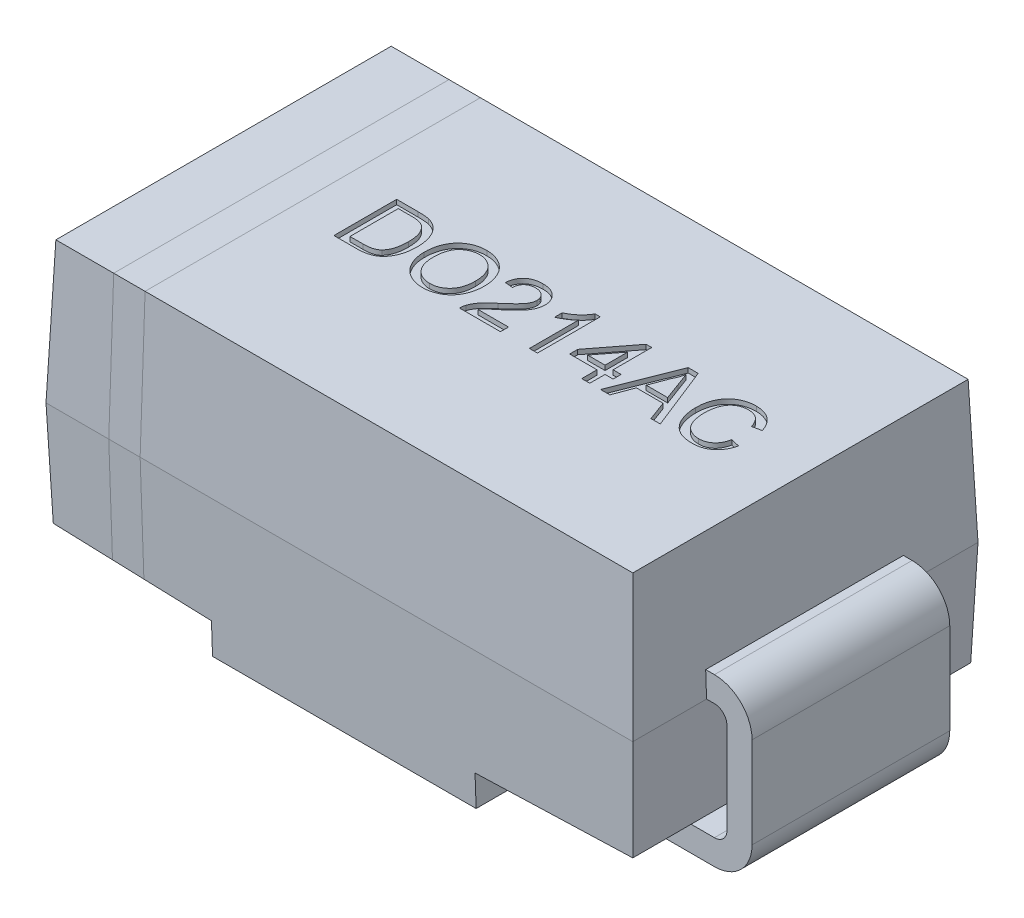
from build123d import *

# Parameters (mm, degrees)
SKETCH1_W                      = 4.7498
SKETCH1_H                      = 2.794
EXTRUDE1_DEPTH                 = 1.143
EXTRUDE1_TAPER                 = 2
EXTRUDE1_OTHER_WAY_DEPTH       = 1.143
EXTRUDE1_OTHER_WAY_TAPER       = 2
CUT_EXTRUDE1_REACH             = 4.983
CUT_EXTRUDE1_DIRECTION_2_REACH = 4.983
EXTRUDE2_DEPTH                 = 0.8001
CUT_EXTRUDE2_DEPTH             = 0.0381


with BuildPart() as part:
    # Sketch1 → Extrude1 (new body)
    with BuildSketch(Plane(origin=(0, 0, 0), x_dir=(1, 0, 0), z_dir=(0, 1, 0))):
        Rectangle(SKETCH1_W, SKETCH1_H)
    extrude(amount=EXTRUDE1_DEPTH, taper=EXTRUDE1_TAPER)

    # Sketch1 → Extrude1 other way (add)
    with BuildSketch(Plane(origin=(0, 0, 0), x_dir=(1, 0, 0), z_dir=(0, 1, 0))):
        Rectangle(SKETCH1_W, SKETCH1_H)
    extrude(amount=-EXTRUDE1_OTHER_WAY_DEPTH, taper=EXTRUDE1_OTHER_WAY_TAPER)

    # Cut-Extrude1: up to this plane
    cut_extrude1_end = Plane(origin=(-2.3749, 0, 1.397), z_dir=(0, -0.034899496702501046, 0.9993908270190958))
    # Sketch2 → Cut-Extrude1 (cut, up to the surface)
    with BuildSketch(Plane.XY, mode=Mode.PRIVATE) as cut_extrude1_sk1:
        Polygon((1.0668, -0.889), (1.0668, -1.143), (2.33498556, -1.143), (2.345414656, -0.844349792), align=None)
    cut_extrude1_tool1 = split(extrude(cut_extrude1_sk1.sketch, amount=CUT_EXTRUDE1_REACH, mode=Mode.PRIVATE), bisect_by=cut_extrude1_end, keep=Keep.BOTH, mode=Mode.PRIVATE)
    add(cut_extrude1_tool1.solids().sort_by_distance((1.720586, -1.004365, 0))[0], mode=Mode.SUBTRACT)
    # Sketch2 → Cut-Extrude1 (cut, up to the surface)
    with BuildSketch(Plane.XY, mode=Mode.PRIVATE) as cut_extrude1_sk2:
        Polygon((-1.0668, -0.889), (-1.0668, -1.143), (-2.33498556, -1.143), (-2.345414656, -0.844349792), align=None)
    cut_extrude1_tool2 = split(extrude(cut_extrude1_sk2.sketch, amount=CUT_EXTRUDE1_REACH, mode=Mode.PRIVATE), bisect_by=cut_extrude1_end, keep=Keep.BOTH, mode=Mode.PRIVATE)
    add(cut_extrude1_tool2.solids().sort_by_distance((-1.720586, -1.004365, 0))[0], mode=Mode.SUBTRACT)

    # Cut-Extrude1 direction 2: up to this plane
    cut_extrude1_direction_2_end = Plane(origin=(-2.3749, 0, -1.397), z_dir=(0, -0.034899496702501046, -0.9993908270190958))
    # Sketch2 → Cut-Extrude1 direction 2 (cut, up to the surface)
    with BuildSketch(Plane.XY, mode=Mode.PRIVATE) as cut_extrude1_direction_2_sk1:
        Polygon((1.0668, -0.889), (1.0668, -1.143), (2.33498556, -1.143), (2.345414656, -0.844349792), align=None)
    cut_extrude1_direction_2_tool1 = split(extrude(cut_extrude1_direction_2_sk1.sketch, amount=-CUT_EXTRUDE1_DIRECTION_2_REACH, mode=Mode.PRIVATE), bisect_by=cut_extrude1_direction_2_end, keep=Keep.BOTH, mode=Mode.PRIVATE)
    add(cut_extrude1_direction_2_tool1.solids().sort_by_distance((1.720586, -1.004365, 0))[0], mode=Mode.SUBTRACT)
    # Sketch2 → Cut-Extrude1 direction 2 (cut, up to the surface)
    with BuildSketch(Plane.XY, mode=Mode.PRIVATE) as cut_extrude1_direction_2_sk2:
        Polygon((-1.0668, -0.889), (-1.0668, -1.143), (-2.33498556, -1.143), (-2.345414656, -0.844349792), align=None)
    cut_extrude1_direction_2_tool2 = split(extrude(cut_extrude1_direction_2_sk2.sketch, amount=-CUT_EXTRUDE1_DIRECTION_2_REACH, mode=Mode.PRIVATE), bisect_by=cut_extrude1_direction_2_end, keep=Keep.BOTH, mode=Mode.PRIVATE)
    add(cut_extrude1_direction_2_tool2.solids().sort_by_distance((-1.720586, -1.004365, 0))[0], mode=Mode.SUBTRACT)

    # Sketch3 → Extrude2 (add, symmetric)
    with BuildSketch(Plane.XY):
        with BuildLine():
            Line((2.3678041, 0.2032), (2.4384, 0.2032))
            ThreePointArc((2.4384, 0.2032), (2.653926147, 0.113926147), (2.7432, -0.1016))
            Line((2.7432, -0.1016), (2.7432, -0.8382))
            ThreePointArc((2.7432, -0.8382), (2.653926147, -1.053726147), (2.4384, -1.143))
            Line((2.4384, -1.143), (1.5367, -1.143))
            Line((1.5367, -1.143), (1.5367, -0.9398))
            Line((1.5367, -0.9398), (2.4384, -0.9398))
            ThreePointArc((2.4384, -0.9398), (2.510242049, -0.910042049), (2.54, -0.8382))
            Line((2.54, -0.8382), (2.54, -0.1016))
            ThreePointArc((2.54, -0.1016), (2.510242049, -0.029757951), (2.4384, 0))
            Line((2.4384, 0), (2.3749, 0))
            Line((2.3749, 0), (2.3678041, 0.2032))
        make_face()
        with BuildLine():
            Line((-2.367463797, 0.212944979), (-2.3749, 0))
            Line((-2.3749, 0), (-2.4384, 0))
            ThreePointArc((-2.4384, 0), (-2.510242049, -0.029757951), (-2.54, -0.1016))
            Line((-2.54, -0.1016), (-2.54, -0.8382))
            ThreePointArc((-2.54, -0.8382), (-2.510242049, -0.910042049), (-2.4384, -0.9398))
            Line((-2.4384, -0.9398), (-1.5367, -0.9398))
            Line((-1.5367, -0.9398), (-1.5367, -1.143))
            Line((-1.5367, -1.143), (-2.4384, -1.143))
            ThreePointArc((-2.4384, -1.143), (-2.653926147, -1.053726147), (-2.7432, -0.8382))
            Line((-2.7432, -0.8382), (-2.7432, -0.1016))
            ThreePointArc((-2.7432, -0.1016), (-2.653926147, 0.113926147), (-2.4384, 0.2032))
            Line((-2.4384, 0.2032), (-2.367463797, 0.212944979))
        make_face()
    extrude(amount=EXTRUDE2_DEPTH, both=True)

    # Sketch5 → Cut-Extrude2 (cut)
    # profile 1 of 7: a face of its own
    with BuildSketch(Plane(origin=(0, 1.143, 0), x_dir=(1, 0, 0), z_dir=(0, 1, 0))):
        with BuildLine():
            Line((-1.239701999, -0.201883132), (-1.239701999, 0.306116868))
            Line((-1.239701999, 0.306116868), (-1.065992864, 0.306116868))
            add(Edge.make_bspline(
                [(-1.065992864, 0.306116868), (-1.061243888, 0.306095414), (-1.052016264, 0.306053727), (-1.038612202, 0.305788039), (-1.026061099, 0.305147202), (-1.014420787, 0.304366578), (-1.003632561, 0.303327244), (-0.993710201, 0.30216501), (-0.984645968, 0.300649027), (-0.978947184, 0.299388963), (-0.976238057, 0.298789945)],
                knots=[0, 0, 0, 0, 1.263127796, 2.454354013, 3.565393221, 4.605443485, 5.557051711, 6.447822442, 7.26211484, 8, 8, 8, 8], degree=3))
            add(Edge.make_bspline(
                [(-0.976238057, 0.298789945), (-0.969231785, 0.296951768), (-0.95546728, 0.293340489), (-0.936037234, 0.285217384), (-0.918199605, 0.275028432), (-0.907620769, 0.266635663), (-0.902358249, 0.262460618)],
                knots=[0, 0, 0, 0, 1.04477941, 2.052571232, 3.03123721, 4, 4, 4, 4], degree=3))
            add(Edge.make_bspline(
                [(-0.902358249, 0.262460618), (-0.89909078, 0.25959125), (-0.892541052, 0.253839526), (-0.88354504, 0.24436314), (-0.875199588, 0.234310235), (-0.86725543, 0.22385388), (-0.860220668, 0.212612863), (-0.853626566, 0.200910731), (-0.847874912, 0.188512489), (-0.842580601, 0.175620761), (-0.837863731, 0.162185298), (-0.833988043, 0.148214777), (-0.83042752, 0.133855083), (-0.827779317, 0.11894925), (-0.825467573, 0.103623709), (-0.824000015, 0.087790743), (-0.823047815, 0.071497617), (-0.822937469, 0.060462837), (-0.822881486, 0.054864464)],
                knots=[0, 0, 0, 0, 0.908997367, 1.822109427, 2.728529095, 3.640759027, 4.565643067, 5.499218265, 6.448003669, 7.421473682, 8.413047621, 9.423472075, 10.452328391, 11.505545429, 12.587978234, 13.692612971, 14.829372988, 16, 16, 16, 16], degree=3))
            add(Edge.make_bspline(
                [(-0.822881486, 0.054864464), (-0.823017946, 0.045495698), (-0.823283494, 0.027264299), (-0.825909664, 0.000747068), (-0.829973439, -0.024178261), (-0.835887689, -0.047362018), (-0.843171704, -0.06867562), (-0.851117933, -0.088293138), (-0.860264607, -0.105876545), (-0.870298303, -0.121574478), (-0.881049143, -0.135486258), (-0.892311923, -0.147820678), (-0.904120032, -0.158583197), (-0.916413485, -0.168056265), (-0.929830751, -0.175900226), (-0.944231069, -0.182943442), (-0.960081634, -0.188602663), (-0.977083949, -0.193552909), (-0.995437713, -0.197261514), (-1.01504354, -0.199986716), (-1.035978483, -0.20163468), (-1.050352268, -0.20179871), (-1.057750076, -0.201883132)],
                knots=[0, 0, 0, 0, 1.410753827, 2.745293735, 4.009435601, 5.211453015, 6.344066657, 7.400119332, 8.396481539, 9.324811333, 10.202671465, 11.041621015, 11.837259285, 12.606727868, 13.374311266, 14.17412185, 15.017911533, 15.905707008, 16.839601966, 17.835295848, 18.885883805, 20, 20, 20, 20], degree=3))
            Line((-1.057750076, -0.201883132), (-1.239701999, -0.201883132))
        make_face()
        with BuildLine():
            Line((-1.168060973, -0.143267747), (-1.063347031, -0.143267747))
            add(Edge.make_bspline(
                [(-1.063347031, -0.143267747), (-1.055711551, -0.143153447), (-1.041266923, -0.142937217), (-1.020887835, -0.141276575), (-1.003101588, -0.138412191), (-0.987710951, -0.134336945), (-0.974357171, -0.129067027), (-0.962599102, -0.122836724), (-0.952140153, -0.115766731), (-0.946248626, -0.110110441), (-0.943368665, -0.107345472)],
                knots=[0, 0, 0, 0, 1.423649224, 2.693227144, 3.808972214, 4.778671344, 5.656058397, 6.479437267, 7.256702014, 8, 8, 8, 8], degree=3))
            add(Edge.make_bspline(
                [(-0.943368665, -0.107345472), (-0.939620972, -0.103060267), (-0.93192192, -0.094256983), (-0.922334603, -0.078878113), (-0.913973997, -0.06157394), (-0.906985005, -0.04216025), (-0.901254212, -0.020702708), (-0.897431992, 0.002990885), (-0.894932992, 0.028759424), (-0.894662746, 0.04668306), (-0.894522512, 0.055983855)],
                knots=[0, 0, 0, 0, 0.782184731, 1.606876467, 2.483531085, 3.422528604, 4.441347086, 5.534669947, 6.720709839, 8, 8, 8, 8], degree=3))
            add(Edge.make_bspline(
                [(-0.894522512, 0.055983855), (-0.8946094, 0.062463826), (-0.894778307, 0.075060626), (-0.895831299, 0.093412052), (-0.89791006, 0.11058715), (-0.900568601, 0.126615628), (-0.904198421, 0.141446535), (-0.908349183, 0.155221969), (-0.913570985, 0.16776185), (-0.9195297, 0.179162987), (-0.92606648, 0.189501095), (-0.93287804, 0.19899823), (-0.939999237, 0.207623254), (-0.947580964, 0.215253449), (-0.955395306, 0.222114456), (-0.963587943, 0.228065808), (-0.972135949, 0.233105676), (-0.978142578, 0.23572191), (-0.981122672, 0.237019913)],
                knots=[0, 0, 0, 0, 1.460126857, 2.838427476, 4.139102445, 5.35666337, 6.496721546, 7.577303074, 8.594995104, 9.55219858, 10.472533725, 11.348579167, 12.184287935, 12.989560785, 13.769667798, 14.524891986, 15.268148459, 16, 16, 16, 16], degree=3))
            add(Edge.make_bspline(
                [(-0.981122672, 0.237019913), (-0.983451199, 0.237872053), (-0.988385196, 0.239677682), (-0.996437956, 0.241721383), (-1.005424918, 0.243602154), (-1.015434664, 0.24492221), (-1.026416568, 0.24620516), (-1.038438894, 0.246984783), (-1.051438591, 0.247338087), (-1.060429648, 0.247445805), (-1.065076999, 0.247501483)],
                knots=[0, 0, 0, 0, 0.699400087, 1.48198292, 2.341906832, 3.289648813, 4.329964754, 5.462247508, 6.688271602, 8, 8, 8, 8], degree=3))
            Line((-1.065076999, 0.247501483), (-1.168060973, 0.247501483))
            Line((-1.168060973, 0.247501483), (-1.168060973, -0.143267747))
        make_face(mode=Mode.SUBTRACT)
    # profile 2 of 7: a face of its own
    with BuildSketch(Plane(origin=(0, 1.143, 0), x_dir=(1, 0, 0), z_dir=(0, 1, 0))):
        with BuildLine():
            add(Edge.make_bspline(
                [(-0.757753281, 0.045400522), (-0.75757672, 0.055585484), (-0.757232699, 0.075430366), (-0.754018329, 0.104327072), (-0.748799016, 0.131515092), (-0.741337548, 0.156992308), (-0.731880115, 0.180798644), (-0.720382798, 0.202988005), (-0.706499766, 0.223309223), (-0.69079452, 0.241955744), (-0.673252481, 0.258440635), (-0.654575195, 0.27308158), (-0.634529442, 0.285293859), (-0.613300429, 0.295377175), (-0.590797963, 0.303118853), (-0.567085224, 0.308538733), (-0.542187573, 0.312035082), (-0.525169446, 0.312428607), (-0.516473633, 0.312629689)],
                knots=[0, 0, 0, 0, 1.203621547, 2.345195544, 3.432004029, 4.472479546, 5.478447225, 6.455936844, 7.420185704, 8.381829745, 9.332027588, 10.260832629, 11.182364398, 12.100723901, 13.034044877, 13.989196293, 14.972532542, 16, 16, 16, 16], degree=3))
            add(Edge.make_bspline(
                [(-0.516473633, 0.312629689), (-0.510738148, 0.312529536), (-0.49934851, 0.312330652), (-0.482509948, 0.310817406), (-0.466104077, 0.308116525), (-0.450147054, 0.304497041), (-0.434595443, 0.299748436), (-0.419439958, 0.294142853), (-0.404813267, 0.287196745), (-0.390618063, 0.279419886), (-0.37702191, 0.270721134), (-0.36424428, 0.261111639), (-0.352315779, 0.250664079), (-0.341076174, 0.239550183), (-0.330900516, 0.227394872), (-0.321368422, 0.214568418), (-0.312753803, 0.200843388), (-0.305026092, 0.186332234), (-0.298116732, 0.171259078), (-0.292211351, 0.155561449), (-0.287140507, 0.139427651), (-0.282895784, 0.122762188), (-0.27985008, 0.105570759), (-0.277424753, 0.087927438), (-0.276148236, 0.069774563), (-0.275920087, 0.057511973), (-0.275804563, 0.051302765)],
                knots=[0, 0, 0, 0, 1.034375294, 2.054082248, 3.045783978, 4.031219655, 5.002789406, 5.976610191, 6.94273282, 7.920236376, 8.894345378, 9.851183672, 10.800797181, 11.752517031, 12.698794154, 13.65688337, 14.632873302, 15.61821402, 16.620222298, 17.621258913, 18.640965868, 19.669244166, 20.720417492, 21.788124603, 22.880008887, 24, 24, 24, 24], degree=3))
            add(Edge.make_bspline(
                [(-0.275804563, 0.051302765), (-0.275910408, 0.044991168), (-0.276119524, 0.03252152), (-0.277534486, 0.014100034), (-0.280022481, -0.003792609), (-0.283322383, -0.021209763), (-0.287744151, -0.038115167), (-0.292998743, -0.054557291), (-0.299354469, -0.070438203), (-0.306532555, -0.085796178), (-0.314654557, -0.100419991), (-0.323613676, -0.114207386), (-0.333416259, -0.127029392), (-0.343913407, -0.139043303), (-0.355350255, -0.150034288), (-0.367585974, -0.160105119), (-0.380573518, -0.169350778), (-0.394356518, -0.177520861), (-0.40868762, -0.184682231), (-0.423283234, -0.191035657), (-0.438154202, -0.196454111), (-0.453351348, -0.200845229), (-0.468833215, -0.204163474), (-0.484556237, -0.206648211), (-0.500571955, -0.208078932), (-0.511348839, -0.208289736), (-0.516778922, -0.208395953)],
                knots=[0, 0, 0, 0, 1.141429366, 2.255090526, 3.338676798, 4.407031443, 5.458968682, 6.496860253, 7.526652771, 8.550250826, 9.560787671, 10.54935636, 11.521089193, 12.477323897, 13.431786008, 14.386110112, 15.340986122, 16.312041, 17.28047646, 18.236612773, 19.189437236, 20.140779471, 21.09494583, 22.051062463, 23.018000708, 24, 24, 24, 24], degree=3))
            add(Edge.make_bspline(
                [(-0.516778922, -0.208395953), (-0.522617467, -0.208309571), (-0.534182162, -0.208138469), (-0.551275094, -0.206430589), (-0.56794278, -0.203825157), (-0.584136765, -0.200063701), (-0.59983492, -0.195156616), (-0.615055821, -0.189217236), (-0.629852999, -0.182324938), (-0.644042848, -0.174282374), (-0.65757707, -0.165339907), (-0.670324487, -0.15554199), (-0.682278049, -0.144978919), (-0.693245952, -0.1334761), (-0.703583412, -0.121450514), (-0.712877089, -0.108455178), (-0.721430501, -0.094784811), (-0.728990539, -0.080307639), (-0.735819902, -0.065453866), (-0.741573788, -0.050218743), (-0.746630338, -0.034826795), (-0.750657369, -0.019183151), (-0.753866422, -0.003323898), (-0.756024278, 0.012724574), (-0.757582698, 0.028986168), (-0.757696134, 0.039901536), (-0.757753281, 0.045400522)],
                knots=[0, 0, 0, 0, 1.072727997, 2.12480551, 3.153819198, 4.171534612, 5.177148798, 6.173931848, 7.17235114, 8.174500385, 9.168706755, 10.151274001, 11.127173509, 12.097141049, 13.070188938, 14.039134204, 15.03036519, 16.031505612, 17.038625933, 18.033164522, 19.022845559, 20.014762458, 21.000193215, 21.994692725, 22.989758729, 24, 24, 24, 24], degree=3))
        make_face()
        with BuildLine():
            add(Edge.make_bspline(
                [(-0.686112255, 0.044586419), (-0.686002469, 0.037252328), (-0.685788393, 0.022951366), (-0.683339249, 0.002101325), (-0.679623064, -0.01757175), (-0.674500696, -0.036123087), (-0.667614978, -0.053369216), (-0.659382211, -0.069475854), (-0.649525196, -0.084335935), (-0.638261407, -0.097907889), (-0.62587253, -0.110099915), (-0.612633758, -0.120749002), (-0.598542115, -0.129666858), (-0.583753832, -0.137030453), (-0.56816269, -0.14277841), (-0.551815387, -0.14681448), (-0.53469991, -0.149338715), (-0.523029266, -0.149631449), (-0.51708421, -0.149780568)],
                knots=[0, 0, 0, 0, 1.215430442, 2.370003584, 3.475209778, 4.53279855, 5.55522989, 6.548792651, 7.526809858, 8.505409025, 9.467826767, 10.404123909, 11.316848639, 12.227335424, 13.138360512, 14.065900994, 15.014765094, 16, 16, 16, 16], degree=3))
            add(Edge.make_bspline(
                [(-0.51708421, -0.149780568), (-0.511038386, -0.149629243), (-0.499200678, -0.149332949), (-0.481827163, -0.14685278), (-0.465320378, -0.142630397), (-0.449516712, -0.13700945), (-0.434701881, -0.129410887), (-0.420529407, -0.120513011), (-0.407385635, -0.109640062), (-0.394947921, -0.097426472), (-0.383792129, -0.083543485), (-0.373893713, -0.068333082), (-0.365852936, -0.051567145), (-0.35891081, -0.033615006), (-0.353827386, -0.014137362), (-0.350070424, 0.006644365), (-0.347806399, 0.028797024), (-0.347567985, 0.044004413), (-0.347445589, 0.05181158)],
                knots=[0, 0, 0, 0, 0.976878588, 1.912725521, 2.8289017, 3.727303729, 4.617335839, 5.514666588, 6.426584173, 7.368641557, 8.327632997, 9.299405846, 10.294892156, 11.327373912, 12.405931897, 13.542618837, 14.738430195, 16, 16, 16, 16], degree=3))
            add(Edge.make_bspline(
                [(-0.347445589, 0.05181158), (-0.347488844, 0.056834202), (-0.347573694, 0.06668677), (-0.348697399, 0.081209568), (-0.350146835, 0.095280623), (-0.352353624, 0.10888178), (-0.355394858, 0.121956712), (-0.35876403, 0.13460496), (-0.362977061, 0.146717528), (-0.367757332, 0.158341916), (-0.373106374, 0.169418447), (-0.379139382, 0.179853742), (-0.385786241, 0.18960723), (-0.392867609, 0.198863829), (-0.400775613, 0.207265268), (-0.409129479, 0.21516643), (-0.418118964, 0.222404075), (-0.427654355, 0.228980092), (-0.437600382, 0.234899544), (-0.447936541, 0.239965827), (-0.458498161, 0.24441592), (-0.46946203, 0.247827104), (-0.480676757, 0.250578273), (-0.492187678, 0.252668042), (-0.50403752, 0.253750222), (-0.512028101, 0.253925644), (-0.516066582, 0.254014304)],
                knots=[0, 0, 0, 0, 1.220438779, 2.394059227, 3.538503547, 4.658058814, 5.74010225, 6.800155734, 7.837851593, 8.854470756, 9.853724944, 10.825214244, 11.781044712, 12.72106398, 13.654479919, 14.581868691, 15.514082315, 16.456304431, 17.39516604, 18.324312202, 19.252140633, 20.177768678, 21.111585046, 22.057694709, 23.018348693, 24, 24, 24, 24], degree=3))
            add(Edge.make_bspline(
                [(-0.516066582, 0.254014304), (-0.521774425, 0.253900948), (-0.533036635, 0.253677285), (-0.549615948, 0.251190923), (-0.565600204, 0.247475959), (-0.581014207, 0.242282241), (-0.595726126, 0.235404941), (-0.60981218, 0.226970875), (-0.623397404, 0.217209688), (-0.636267579, 0.205883551), (-0.648265397, 0.192872584), (-0.658408349, 0.177533053), (-0.666957105, 0.160231145), (-0.67409516, 0.141010715), (-0.679537716, 0.119722914), (-0.683299203, 0.096459355), (-0.685674129, 0.071195522), (-0.68596248, 0.053682874), (-0.686112255, 0.044586419)],
                knots=[0, 0, 0, 0, 0.895090134, 1.766112571, 2.624765742, 3.468151641, 4.313618154, 5.168136083, 6.041303099, 6.935189387, 7.854749729, 8.809996334, 9.809869957, 10.877771942, 12.021723904, 13.25217762, 14.572720513, 16, 16, 16, 16], degree=3))
        make_face(mode=Mode.SUBTRACT)
    # profile 3 of 7: a face of its own
    with BuildSketch(Plane(origin=(0, 1.143, 0), x_dir=(1, 0, 0), z_dir=(0, 1, 0))):
        with BuildLine():
            Line((0.108451847, -0.136754927), (0.108451847, -0.201883132))
            Line((0.108451847, -0.201883132), (-0.223701999, -0.201883132))
            add(Edge.make_bspline(
                [(-0.223701999, -0.201883132), (-0.223708799, -0.19801238), (-0.223722376, -0.190283849), (-0.222414584, -0.178853842), (-0.22036632, -0.167575464), (-0.218050349, -0.160343089), (-0.21688389, -0.15670044)],
                knots=[0, 0, 0, 0, 1.01057331, 2.01775941, 3.001627217, 4, 4, 4, 4], degree=3))
            add(Edge.make_bspline(
                [(-0.21688389, -0.15670044), (-0.214728661, -0.150748786), (-0.210340261, -0.138630238), (-0.201449316, -0.121144867), (-0.190991464, -0.103765243), (-0.180809273, -0.089615776), (-0.171484585, -0.07831134), (-0.163664619, -0.069466928), (-0.154998662, -0.06041363), (-0.145493656, -0.051153099), (-0.13524108, -0.04162536), (-0.124226944, -0.031798637), (-0.112321189, -0.021856062), (-0.104009726, -0.01526571), (-0.099754883, -0.011891946)],
                knots=[0, 0, 0, 0, 1.204657718, 2.452881516, 3.728232997, 5.065887527, 5.768225529, 6.518857853, 7.313994055, 8.154655305, 9.046094665, 9.979688118, 10.965752482, 12, 12, 12, 12], degree=3))
            add(Edge.make_bspline(
                [(-0.099754883, -0.011891946), (-0.093218394, -0.006390289), (-0.080631968, 0.004203501), (-0.062857963, 0.019923704), (-0.046624302, 0.034520803), (-0.032189488, 0.048250642), (-0.01943546, 0.06098005), (-0.008332271, 0.072680187), (0.001215614, 0.083314539), (0.009091635, 0.093268026), (0.015736875, 0.102666886), (0.02136813, 0.111834894), (0.026061033, 0.120932194), (0.029969593, 0.12993), (0.033060933, 0.138866791), (0.03516812, 0.147768604), (0.036597142, 0.156547111), (0.036740117, 0.162388427), (0.036810822, 0.165277124)],
                knots=[0, 0, 0, 0, 1.782554561, 3.432421876, 4.950675607, 6.337395053, 7.588547463, 8.709982106, 9.702713005, 10.569305638, 11.356701089, 12.103210377, 12.812277205, 13.490692607, 14.148717897, 14.782152033, 15.397739362, 16, 16, 16, 16], degree=3))
            add(Edge.make_bspline(
                [(0.036810822, 0.165277124), (0.036740108, 0.168132117), (0.036601372, 0.173733459), (0.035285049, 0.181930986), (0.033452622, 0.189825402), (0.030490145, 0.197274587), (0.026963906, 0.204499143), (0.022440653, 0.211270782), (0.017208179, 0.21775827), (0.01121744, 0.223790564), (0.004674149, 0.229449818), (-0.002637045, 0.234154034), (-0.010235947, 0.238389229), (-0.018384711, 0.241794569), (-0.027070097, 0.244295171), (-0.036228878, 0.246109964), (-0.045859602, 0.24726064), (-0.052431894, 0.247419985), (-0.055793345, 0.247501483)],
                knots=[0, 0, 0, 0, 0.988194508, 1.938783882, 2.870742509, 3.789494954, 4.709148727, 5.651055405, 6.603531303, 7.592354411, 8.592907906, 9.593461401, 10.59787167, 11.603930315, 12.645063138, 13.723588815, 14.835711238, 16, 16, 16, 16], degree=3))
            add(Edge.make_bspline(
                [(-0.055793345, 0.247501483), (-0.059324456, 0.247420389), (-0.066235101, 0.24726168), (-0.076336612, 0.246106415), (-0.085926246, 0.244341326), (-0.094981114, 0.241642656), (-0.103490194, 0.238242995), (-0.111418832, 0.233963727), (-0.118893997, 0.229133207), (-0.125680269, 0.223414235), (-0.131817005, 0.217073063), (-0.137264998, 0.210169444), (-0.14172881, 0.202570154), (-0.14541521, 0.194442283), (-0.148379384, 0.185760281), (-0.150531273, 0.176457775), (-0.151704498, 0.166561626), (-0.151940423, 0.159784746), (-0.152060973, 0.156321996)],
                knots=[0, 0, 0, 0, 1.131143733, 2.213731411, 3.253917892, 4.251203413, 5.236093891, 6.184197493, 7.13373276, 8.082770301, 9.020476205, 9.957489029, 10.893177274, 11.836722509, 12.812818608, 13.827831385, 14.890097571, 16, 16, 16, 16], degree=3))
            Line((-0.152060973, 0.156321996), (-0.217189178, 0.162834817))
            add(Edge.make_bspline(
                [(-0.217189178, 0.162834817), (-0.216522824, 0.168510899), (-0.21522649, 0.179553228), (-0.211997497, 0.195546182), (-0.207464284, 0.210424214), (-0.202039913, 0.224394754), (-0.195239951, 0.237219983), (-0.18755318, 0.249165174), (-0.178486989, 0.259851478), (-0.168471252, 0.269615741), (-0.157396238, 0.278220626), (-0.145365978, 0.285738187), (-0.132385975, 0.292026164), (-0.118528524, 0.297232346), (-0.103761811, 0.301182407), (-0.088106727, 0.304014974), (-0.071538095, 0.305761), (-0.060173468, 0.305996553), (-0.054368665, 0.306116868)],
                knots=[0, 0, 0, 0, 1.130804643, 2.199883102, 3.223565206, 4.205909148, 5.160801384, 6.091796021, 7.01151579, 7.927798993, 8.855738875, 9.7815393, 10.730299821, 11.705391175, 12.706931101, 13.751121791, 14.851322166, 16, 16, 16, 16], degree=3))
            add(Edge.make_bspline(
                [(-0.054368665, 0.306116868), (-0.048494382, 0.306016278), (-0.037051244, 0.305820327), (-0.020376753, 0.303815357), (-0.004643909, 0.300692635), (0.010204963, 0.296340516), (0.024082133, 0.290633591), (0.036998278, 0.283661017), (0.04901295, 0.27549081), (0.059925409, 0.266024892), (0.069765459, 0.255691256), (0.078388811, 0.244663039), (0.085598349, 0.232987353), (0.091736823, 0.220823347), (0.096289955, 0.207914002), (0.099491802, 0.194434824), (0.10166755, 0.180374295), (0.101847331, 0.170780763), (0.101939027, 0.165887701)],
                knots=[0, 0, 0, 0, 1.195390245, 2.328627238, 3.413424916, 4.457841177, 5.473507151, 6.462241215, 7.441013641, 8.425227782, 9.397253344, 10.342087291, 11.269524934, 12.186751184, 13.110685745, 14.048630397, 15.004728144, 16, 16, 16, 16], degree=3))
            add(Edge.make_bspline(
                [(0.101939027, 0.165887701), (0.10179901, 0.160860635), (0.101518666, 0.150795408), (0.099330547, 0.135750862), (0.09558665, 0.120869583), (0.090623243, 0.105970457), (0.083842195, 0.090994349), (0.075275493, 0.075734664), (0.064647563, 0.060135034), (0.054426474, 0.046873616), (0.044912299, 0.035757203), (0.036478882, 0.026607746), (0.026721906, 0.016887059), (0.016007393, 0.006258494), (0.003898353, -0.004900721), (-0.009257293, -0.016924754), (-0.023747529, -0.029497178), (-0.033806577, -0.038086055), (-0.03900248, -0.042522555)],
                knots=[0, 0, 0, 0, 0.927118007, 1.856282007, 2.79721255, 3.754929441, 4.749232485, 5.824981375, 6.979078785, 8.228161913, 8.911614355, 9.677694854, 10.522803217, 11.452009355, 12.461436787, 13.560019032, 14.739651695, 16, 16, 16, 16], degree=3))
            add(Edge.make_bspline(
                [(-0.03900248, -0.042522555), (-0.043451985, -0.046144927), (-0.051936508, -0.053052233), (-0.064007386, -0.06306594), (-0.07481922, -0.072248237), (-0.084624845, -0.080299617), (-0.093067146, -0.087609513), (-0.100443491, -0.093857785), (-0.106485894, -0.099358594), (-0.115687403, -0.107714433), (-0.127341899, -0.119624836), (-0.135929431, -0.131197843), (-0.14005296, -0.136754927)],
                knots=[0, 0, 0, 0, 1.241996727, 2.368296581, 3.394949853, 4.3125351, 5.114548721, 5.812230366, 6.404953749, 6.883082049, 8.503329734, 10, 10, 10, 10], degree=3))
            Line((-0.14005296, -0.136754927), (0.108451847, -0.136754927))
        make_face()
    # profile 4 of 7: a face of its own
    with BuildSketch(Plane(origin=(0, 1.143, 0), x_dir=(1, 0, 0), z_dir=(0, 1, 0))):
        with BuildLine():
            Line((0.408041591, -0.201883132), (0.342913386, -0.201883132))
            Line((0.342913386, -0.201883132), (0.342913386, 0.19397424))
            add(Edge.make_bspline(
                [(0.342913386, 0.19397424), (0.339163298, 0.190357741), (0.331369151, 0.182841246), (0.31819397, 0.172203528), (0.303488784, 0.16142175), (0.287444549, 0.151053865), (0.271090166, 0.141293619), (0.25528576, 0.132515779), (0.240295193, 0.125087596), (0.230420826, 0.121025837), (0.225682617, 0.119076804)],
                knots=[0, 0, 0, 0, 0.893362401, 1.856755847, 2.901947673, 4.020460078, 5.132200827, 6.168787962, 7.121294059, 8, 8, 8, 8], degree=3))
            Line((0.225682617, 0.119076804), (0.225682617, 0.179116868))
            add(Edge.make_bspline(
                [(0.225682617, 0.179116868), (0.23382098, 0.183308142), (0.249861213, 0.191568894), (0.272522594, 0.205836348), (0.29367943, 0.221302856), (0.312981493, 0.237964993), (0.330284562, 0.254996688), (0.34486611, 0.272182337), (0.357067022, 0.288891989), (0.36318845, 0.300545118), (0.366115309, 0.306116868)],
                knots=[0, 0, 0, 0, 1.141258006, 2.249351951, 3.335817539, 4.406819942, 5.426913362, 6.360259544, 7.215985427, 8, 8, 8, 8], degree=3))
            Line((0.366115309, 0.306116868), (0.408041591, 0.306116868))
            Line((0.408041591, 0.306116868), (0.408041591, -0.201883132))
        make_face()
    # profile 5 of 7: a face of its own
    with BuildSketch(Plane(origin=(0, 1.143, 0), x_dir=(1, 0, 0), z_dir=(0, 1, 0))):
        Polygon((0.766246719, -0.201883132), (0.766246719, -0.078139542), (0.544810822, -0.078139542), (0.544810822, -0.013011337), (0.785785181, 0.299604047), (0.831374924, 0.299604047), (0.831374924, -0.013011337), (0.896503129, -0.013011337), (0.896503129, -0.078139542), (0.831374924, -0.078139542), (0.831374924, -0.201883132), align=None)
        Polygon((0.766246719, -0.013011337), (0.766246719, 0.169958214), (0.62520345, -0.013011337), align=None, mode=Mode.SUBTRACT)
    # profile 6 of 7: a face of its own
    with BuildSketch(Plane(origin=(0, 1.143, 0), x_dir=(1, 0, 0), z_dir=(0, 1, 0))):
        Polygon((0.91817861, -0.201883132), (1.11987252, 0.306116868), (1.2006722, 0.306116868), (1.40236611, -0.201883132), (1.326349283, -0.201883132), (1.268548001, -0.04557544), (1.051996719, -0.04557544), (0.994195437, -0.201883132), align=None)
        with BuildLine():
            Line((1.073570437, 0.013039945), (1.246974283, 0.013039945))
            Line((1.246974283, 0.013039945), (1.197619315, 0.146552765))
            add(Edge.make_bspline(
                [(1.197619315, 0.146552765), (1.195727222, 0.151711519), (1.192027822, 0.161797856), (1.186510903, 0.176452452), (1.181470735, 0.190369058), (1.176528435, 0.20334813), (1.172066934, 0.215578201), (1.167954653, 0.226976664), (1.163887642, 0.237464293), (1.161446972, 0.244240381), (1.16027236, 0.247501483)],
                knots=[0, 0, 0, 0, 1.225184869, 2.395467751, 3.491410812, 4.525364584, 5.492066482, 6.394148129, 7.227157926, 8, 8, 8, 8], degree=3))
            add(Edge.make_bspline(
                [(1.16027236, 0.247501483), (1.158329325, 0.239459893), (1.154435244, 0.223343555), (1.146281986, 0.199730958), (1.136954941, 0.176334308), (1.12938027, 0.161257667), (1.125571238, 0.153676163)],
                knots=[0, 0, 0, 0, 0.9891762, 1.982431084, 2.985436691, 4, 4, 4, 4], degree=3))
            Line((1.125571238, 0.153676163), (1.073570437, 0.013039945))
        make_face(mode=Mode.SUBTRACT)
    # profile 7 of 7: a face of its own
    with BuildSketch(Plane(origin=(0, 1.143, 0), x_dir=(1, 0, 0), z_dir=(0, 1, 0))):
        with BuildLine():
            Line((1.801785181, -0.022577042), (1.873426206, -0.039266145))
            add(Edge.make_bspline(
                [(1.873426206, -0.039266145), (1.871631399, -0.045980859), (1.868120532, -0.059115674), (1.861179122, -0.077913047), (1.853388241, -0.095553581), (1.844558847, -0.111990805), (1.834594302, -0.127130218), (1.823758627, -0.141166388), (1.811622636, -0.153804965), (1.798631612, -0.165337641), (1.784684408, -0.17550943), (1.769949178, -0.184292956), (1.754497149, -0.191765954), (1.738265868, -0.197911288), (1.721244814, -0.202536179), (1.703521627, -0.205907071), (1.685044629, -0.207983344), (1.672450073, -0.208256691), (1.666033578, -0.208395953)],
                knots=[0, 0, 0, 0, 1.145254194, 2.240259345, 3.299159039, 4.322497661, 5.312016644, 6.284080175, 7.241264552, 8.196044782, 9.144516039, 10.082428046, 11.020306713, 11.970622414, 12.939253955, 13.924100776, 14.94240044, 16, 16, 16, 16], degree=3))
            add(Edge.make_bspline(
                [(1.666033578, -0.208395953), (1.65945013, -0.208300307), (1.64657014, -0.208113184), (1.627701697, -0.206591174), (1.609755956, -0.203951485), (1.592766428, -0.200284015), (1.57667593, -0.195749415), (1.561551184, -0.190044488), (1.547418682, -0.183210396), (1.53416054, -0.175438266), (1.52183307, -0.166608777), (1.510155941, -0.156960212), (1.499412634, -0.146226958), (1.489334527, -0.134662435), (1.480141125, -0.122114092), (1.471494199, -0.108752404), (1.463815802, -0.094341938), (1.456821377, -0.079149864), (1.450682222, -0.06332327), (1.445251216, -0.047174773), (1.440811073, -0.030672197), (1.436988395, -0.013954408), (1.434211406, 0.003119264), (1.432006562, 0.020420712), (1.430794294, 0.038056011), (1.430634772, 0.04991033), (1.430554411, 0.055882092)],
                knots=[0, 0, 0, 0, 1.180702053, 2.309949215, 3.392367133, 4.431746864, 5.425408375, 6.388154007, 7.326956194, 8.237882283, 9.141054626, 10.043899035, 10.951650021, 11.86168169, 12.792564695, 13.739356664, 14.713891418, 15.718426911, 16.737522708, 17.757217648, 18.772674716, 19.801476837, 20.831699174, 21.873853055, 22.928926693, 24, 24, 24, 24], degree=3))
            add(Edge.make_bspline(
                [(1.430554411, 0.055882092), (1.430669345, 0.062328851), (1.430896424, 0.075066017), (1.432178281, 0.093860076), (1.434532587, 0.111998642), (1.437802035, 0.129493646), (1.441939194, 0.146359257), (1.447046052, 0.162603692), (1.45305801, 0.178206165), (1.459956737, 0.193183882), (1.467788068, 0.207369653), (1.47631827, 0.220783642), (1.485750821, 0.233205599), (1.495806059, 0.244872848), (1.506735122, 0.255591117), (1.518504636, 0.265384685), (1.531013059, 0.274342882), (1.544258565, 0.282382543), (1.558068021, 0.289436925), (1.572236311, 0.295720325), (1.586819788, 0.300870425), (1.601702832, 0.305152526), (1.616917482, 0.308561477), (1.632499291, 0.310841052), (1.648433861, 0.3123266), (1.659178192, 0.312527928), (1.664608899, 0.312629689)],
                knots=[0, 0, 0, 0, 1.185634383, 2.342514083, 3.462112933, 4.547331452, 5.613960142, 6.653690668, 7.676612054, 8.686959706, 9.683658101, 10.654407272, 11.607580201, 12.5494388, 13.484601218, 14.419076806, 15.362504069, 16.311442244, 17.265594461, 18.212500624, 19.159571152, 20.107257795, 21.059246075, 22.024387127, 23.001429356, 24, 24, 24, 24], degree=3))
            add(Edge.make_bspline(
                [(1.664608899, 0.312629689), (1.670685128, 0.312515155), (1.682628557, 0.312290027), (1.700153413, 0.310438307), (1.716937648, 0.307336878), (1.733053993, 0.303268098), (1.748334889, 0.29769709), (1.762946237, 0.291073802), (1.776742682, 0.283116724), (1.789831573, 0.274044531), (1.801999842, 0.263840491), (1.813417771, 0.252748377), (1.823619798, 0.240490965), (1.833009985, 0.227364908), (1.841292885, 0.213188192), (1.848773217, 0.198084422), (1.855206085, 0.18194132), (1.85864799, 0.170697203), (1.860400565, 0.164971836)],
                knots=[0, 0, 0, 0, 1.098391872, 2.158997981, 3.181470371, 4.182549255, 5.160268219, 6.118029851, 7.079534476, 8.035645336, 8.993622929, 9.94770573, 10.909620999, 11.872786677, 12.862530088, 13.874594564, 14.917769567, 16, 16, 16, 16], degree=3))
            Line((1.860400565, 0.164971836), (1.78875954, 0.14960565))
            add(Edge.make_bspline(
                [(1.78875954, 0.14960565), (1.787352622, 0.153999575), (1.784598848, 0.162599846), (1.779709253, 0.174856761), (1.774428654, 0.186235182), (1.768631263, 0.196657765), (1.762304514, 0.206127005), (1.755594096, 0.214757988), (1.748339235, 0.222389615), (1.740687501, 0.229197852), (1.732441302, 0.234997818), (1.723793966, 0.240137542), (1.714563165, 0.24438988), (1.704881688, 0.24798648), (1.694659046, 0.25072388), (1.683936866, 0.252649749), (1.672705727, 0.253764347), (1.665052337, 0.253929879), (1.661148963, 0.254014304)],
                knots=[0, 0, 0, 0, 1.235697765, 2.418642872, 3.532555292, 4.594392283, 5.610119701, 6.580908344, 7.519430642, 8.427315627, 9.319973334, 10.216139639, 11.118687699, 12.038725643, 12.980015607, 13.949697744, 14.954307006, 16, 16, 16, 16], degree=3))
            add(Edge.make_bspline(
                [(1.661148963, 0.254014304), (1.656667532, 0.253949283), (1.647853881, 0.253821405), (1.634905567, 0.252421802), (1.622470681, 0.250360323), (1.610641902, 0.247268959), (1.5993545, 0.243414831), (1.588675458, 0.238615759), (1.578513934, 0.232990685), (1.568983336, 0.226505828), (1.560163761, 0.2192156), (1.55181587, 0.21150869), (1.544340455, 0.203025662), (1.537452457, 0.194046238), (1.531352452, 0.184411743), (1.525861426, 0.174253411), (1.52101438, 0.163487988), (1.515730771, 0.148336469), (1.510343423, 0.128821663), (1.505669892, 0.104941866), (1.502692963, 0.080685845), (1.50236163, 0.064370802), (1.502195437, 0.056187381)],
                knots=[0, 0, 0, 0, 0.935256702, 1.839373932, 2.716087708, 3.564631604, 4.388828665, 5.203538865, 6.005592122, 6.810952829, 7.606223804, 8.392839071, 9.180346482, 9.963639178, 10.753404291, 11.558266631, 12.372976832, 13.215232055, 14.905983541, 16.594894834, 18.292041732, 20, 20, 20, 20], degree=3))
            add(Edge.make_bspline(
                [(1.502195437, 0.056187381), (1.502382879, 0.045898098), (1.502746533, 0.025935956), (1.506334903, -0.002992483), (1.511805866, -0.029974931), (1.51840853, -0.051026617), (1.525031665, -0.066554736), (1.530388124, -0.077429302), (1.536502309, -0.087492098), (1.543222136, -0.096800272), (1.550634166, -0.105326671), (1.558635132, -0.11311659), (1.567226822, -0.120244984), (1.576511041, -0.126378162), (1.586130426, -0.131823889), (1.595963589, -0.136666333), (1.60601672, -0.140761858), (1.61633038, -0.143943345), (1.626759738, -0.146692592), (1.637419662, -0.14848853), (1.648307113, -0.1495021), (1.655617767, -0.149687001), (1.659317232, -0.149780568)],
                knots=[0, 0, 0, 0, 2.10686522, 4.087509323, 5.961373225, 7.741398778, 8.594514555, 9.418024779, 10.222433421, 11.003575649, 11.767087398, 12.533660211, 13.289033706, 14.050297079, 14.809623433, 15.552362432, 16.294320901, 17.0305302, 17.761969017, 18.502233515, 19.242073914, 20, 20, 20, 20], degree=3))
            add(Edge.make_bspline(
                [(1.659317232, -0.149780568), (1.663732037, -0.14968798), (1.672452839, -0.149505087), (1.685238641, -0.147904209), (1.697563978, -0.145545107), (1.709279531, -0.141904773), (1.720542886, -0.137447612), (1.731261759, -0.131951152), (1.741402442, -0.125340515), (1.751084211, -0.117834758), (1.760128526, -0.109294488), (1.768417155, -0.099788512), (1.775852991, -0.089273492), (1.782747882, -0.077918179), (1.788540858, -0.065383348), (1.793906522, -0.052042606), (1.79837758, -0.037676688), (1.800632997, -0.02768256), (1.801785181, -0.022577042)],
                knots=[0, 0, 0, 0, 1.013374089, 2.001772144, 2.95501459, 3.891367103, 4.814208647, 5.733921849, 6.652182523, 7.590185968, 8.54346024, 9.504121027, 10.481158517, 11.497760682, 12.549996529, 13.647863555, 14.798406869, 16, 16, 16, 16], degree=3))
        make_face()
    extrude(amount=-CUT_EXTRUDE2_DEPTH, mode=Mode.SUBTRACT)


solid = part.part
